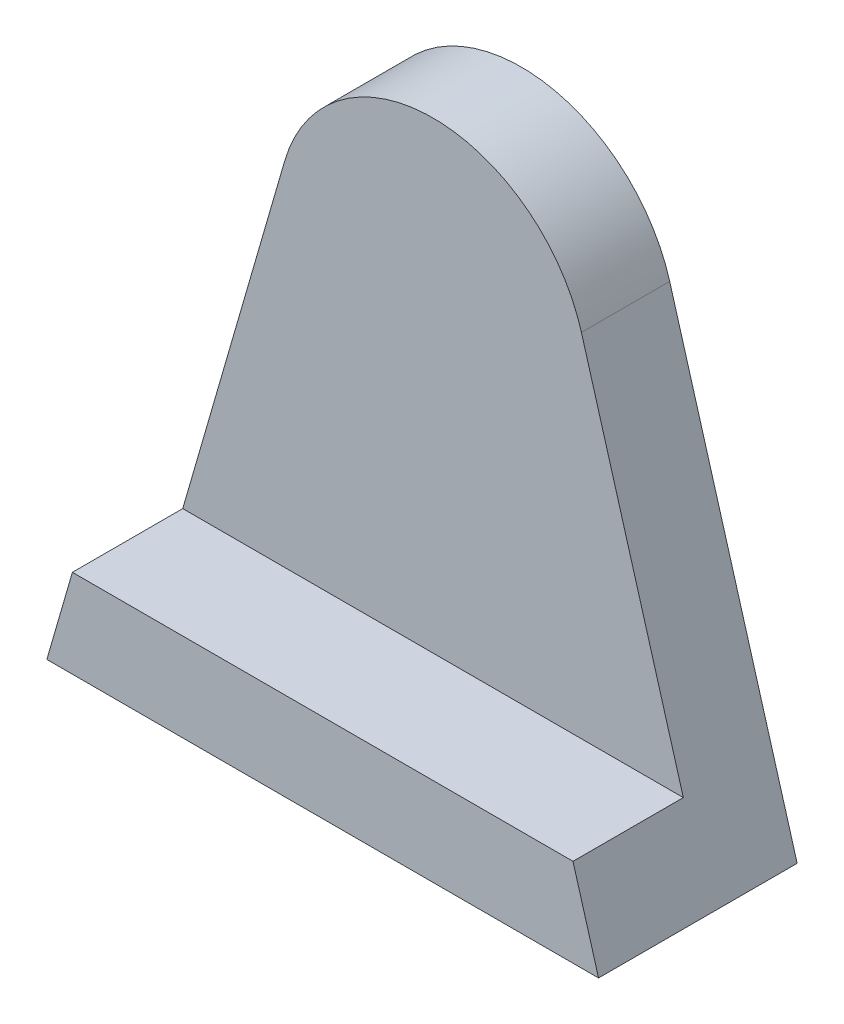
from build123d import *

# Parameters (mm, degrees)
BOSS_EXTRUDE1_DEPTH = 4
BOSS_EXTRUDE2_DEPTH = 5


with BuildPart() as part:
    # Sketch1 → Boss-Extrude1 (new body)
    with BuildSketch(Plane.XY):
        with BuildLine():
            Line((-12.5, 0), (-6.723761618, 19.947056679))
            ThreePointArc((-6.723761618, 19.947056679), (0, 25), (6.723761618, 19.947056679))
            Line((6.723761618, 19.947056679), (12.5, 0))
            Line((12.5, 0), (-12.5, 0))
        make_face()
    extrude(amount=BOSS_EXTRUDE1_DEPTH)

    # Sketch2 → Boss-Extrude2 (add)
    with BuildSketch(Plane.XY.offset(4)):
        Polygon((-12.5, 0), (12.5, 0), (11.341686074, 4), (-11.341686074, 4), align=None)
    extrude(amount=BOSS_EXTRUDE2_DEPTH)


solid = part.part
